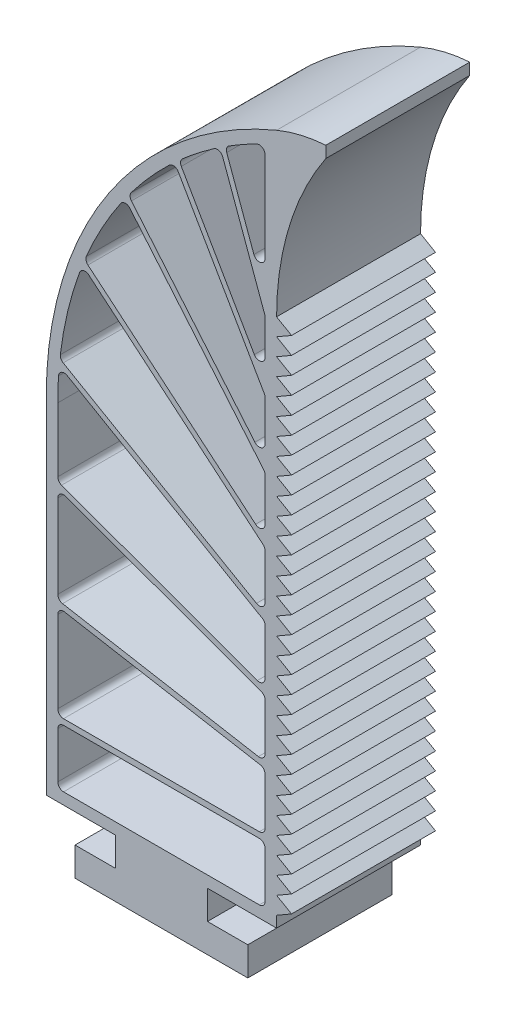
from build123d import *

# Parameters (mm, degrees)
BOSS_EXTRUDE1_DEPTH = 25
SKETCH3_W           = 36
SKETCH3_H           = 10
CUT_EXTRUDE1_DEPTH  = 134.88427839
CUT_EXTRUDE2_DEPTH  = 134.88427839
CUT_EXTRUDE3_DEPTH  = 134.88427839
CUT_EXTRUDE4_DEPTH  = 134.88427839
CUT_EXTRUDE5_DEPTH  = 134.88427839
CUT_EXTRUDE6_DEPTH  = 134.88427839
CUT_EXTRUDE7_DEPTH  = 134.88427839
CUT_EXTRUDE8_DEPTH  = 134.88427839
CUT_EXTRUDE9_DEPTH  = 134.88427839
FILLET1_R           = 1
BOSS_EXTRUDE2_DEPTH = 25
BOSS_EXTRUDE3_DEPTH = 25
LPATTERN1_COUNT     = 30
LPATTERN1_PITCH     = 3


with BuildPart() as part:
    # Sketch2 → Boss-Extrude1 (new body)
    with BuildSketch(Plane.XY):
        with BuildLine():
            Line((-15, 0), (15, 0))
            Line((15, 0), (15, 5))
            Line((15, 5), (8, 5))
            Line((8, 5), (8, 10))
            Line((8, 10), (20, 10))
            Line((20, 10), (20, 130))
            ThreePointArc((20, 130), (-9.083269132, 106.055512755), (-20, 70))
            Line((-20, 70), (-20, 10))
            Line((-20, 10), (-8, 10))
            Line((-8, 10), (-8, 5))
            Line((-8, 5), (-15, 5))
            Line((-15, 5), (-15, 0))
        make_face()
    extrude(amount=BOSS_EXTRUDE1_DEPTH)

    # Sketch3 → Cut-Extrude1 (cut, through all)
    with BuildSketch(Plane.XY.offset(25)):
        with Locations((0, 17)):
            Rectangle(SKETCH3_W, SKETCH3_H)
    extrude(amount=-CUT_EXTRUDE1_DEPTH, mode=Mode.SUBTRACT)

    # Sketch4 → Cut-Extrude2 (cut, through all)
    with BuildSketch(Plane.XY.offset(25)):
        Polygon((-18, 23), (18, 23), (18, 33), (-18, 39.347771306), align=None)
    extrude(amount=-CUT_EXTRUDE2_DEPTH, mode=Mode.SUBTRACT)

    # Sketch5 → Cut-Extrude3 (cut, through all)
    with BuildSketch(Plane.XY.offset(25)):
        Polygon((-18, 40.363197917), (18, 34.015426612), (18, 44.015426612), (-18, 57.118355045), align=None)
    extrude(amount=-CUT_EXTRUDE3_DEPTH, mode=Mode.SUBTRACT)

    # Sketch6 → Cut-Extrude4 (cut, through all)
    with BuildSketch(Plane.XY.offset(25)):
        with BuildLine():
            Line((-18, 58.182532818), (18, 45.079604384))
            Line((18, 45.079604384), (18, 55.079604384))
            Line((18, 55.079604384), (-17.740313653, 75.714284093))
            ThreePointArc((-17.740313653, 75.714284093), (-17.935044928, 72.860090894), (-18, 70))
            Line((-18, 70), (-18, 58.182532818))
        make_face()
    extrude(amount=-CUT_EXTRUDE4_DEPTH, mode=Mode.SUBTRACT)

    # Sketch12 → Cut-Extrude5 (cut, through all)
    with BuildSketch(Plane.XY.offset(25)):
        with BuildLine():
            Line((-17.631285006, 76.806036913), (18, 56.234304923))
            Line((18, 56.234304923), (18, 66.234304923))
            Line((18, 66.234304923), (-13.712387619, 92.844157678))
            ThreePointArc((-13.712387619, 92.844157678), (-16.199485709, 84.954027852), (-17.631285006, 76.806036913))
        make_face()
    extrude(amount=-CUT_EXTRUDE5_DEPTH, mode=Mode.SUBTRACT)

    # Sketch7 → Cut-Extrude6 (cut, through all)
    with BuildSketch(Plane.XY.offset(25)):
        with BuildLine():
            Line((-13.322364363, 93.822296597), (18, 67.539712212))
            Line((18, 67.539712212), (18, 77.539712212))
            Line((18, 77.539712212), (-6.326939086, 106.531429264))
            ThreePointArc((-6.326939086, 106.531429264), (-10.191692762, 100.378891521), (-13.322364363, 93.822296597))
        make_face()
    extrude(amount=-CUT_EXTRUDE6_DEPTH, mode=Mode.SUBTRACT)

    # Sketch8 → Cut-Extrude7 (cut, through all)
    with BuildSketch(Plane.XY.offset(25)):
        with BuildLine():
            Line((-5.722234691, 107.366494456), (18, 79.095436039))
            Line((18, 79.095436039), (18, 89.095436039))
            Line((18, 89.095436039), (2.287500379, 116.310283697))
            ThreePointArc((2.287500379, 116.310283697), (-1.93090917, 112.029629602), (-5.722234691, 107.366494456))
        make_face()
    extrude(amount=-CUT_EXTRUDE7_DEPTH, mode=Mode.SUBTRACT)

    # Sketch9 → Cut-Extrude8 (cut, through all)
    with BuildSketch(Plane.XY.offset(25)):
        with BuildLine():
            Line((3.04523541, 116.997848123), (18, 91.095436039))
            Line((18, 91.095436039), (18, 101.095436039))
            Line((18, 101.095436039), (10.202779023, 122.518124607))
            ThreePointArc((10.202779023, 122.518124607), (6.524875761, 119.886519369), (3.04523541, 116.997848123))
        make_face()
    extrude(amount=-CUT_EXTRUDE8_DEPTH, mode=Mode.SUBTRACT)

    # Sketch10 → Cut-Extrude9 (cut, through all)
    with BuildSketch(Plane.XY.offset(25)):
        with BuildLine():
            Line((11.063128519, 123.078138194), (18, 104.019240439))
            Line((18, 104.019240439), (18, 126.920997883))
            ThreePointArc((18, 126.920997883), (14.471038847, 125.108824438), (11.063128519, 123.078138194))
        make_face()
    extrude(amount=-CUT_EXTRUDE9_DEPTH, mode=Mode.SUBTRACT)

    # Fillet1
    fillet1_edges = [part.edges().sort_by_distance(p)[0] for p in [
        (-17.631285006, 76.806036913, 12.5),
        (-13.712387619, 92.844157678, 12.5),
        (18, 66.234304923, 12.5),
        (18, 56.234304923, 12.5),
        (-13.322364363, 93.822296597, 12.5),
        (-6.326939086, 106.531429264, 12.5),
        (18, 77.539712212, 12.5),
        (18, 67.539712212, 12.5),
        (-5.722234691, 107.366494456, 12.5),
        (2.287500379, 116.310283697, 12.5),
        (18, 89.095436039, 12.5),
        (18, 79.095436039, 12.5),
        (3.04523541, 116.997848123, 12.5),
        (10.202779023, 122.518124607, 12.5),
        (18, 101.095436039, 12.5),
        (18, 91.095436039, 12.5),
        (11.063128519, 123.078138194, 12.5),
        (18, 126.920997883, 12.5),
        (18, 104.019240439, 12.5),
        (-18, 12, 12.5),
        (-18, 22, 12.5),
        (18, 22, 12.5),
        (18, 12, 12.5),
        (-18, 23, 12.5),
        (-18, 39.347771306, 12.5),
        (18, 33, 12.5),
        (18, 23, 12.5),
        (-18, 40.363197917, 12.5),
        (-18, 57.118355045, 12.5),
        (18, 44.015426612, 12.5),
        (18, 34.015426612, 12.5),
        (-18, 58.182532818, 12.5),
        (-17.740313653, 75.714284093, 12.5),
        (18, 55.079604384, 12.5),
        (18, 45.079604384, 12.5),
    ]]
    fillet(fillet1_edges, radius=FILLET1_R)

    # Sketch13 → Boss-Extrude2 (add)
    with BuildSketch(Plane.XY.offset(25)):
        with BuildLine():
            Line((28.543587015, 132.015112463), (28.543587015, 130.015112463))
            ThreePointArc((28.543587015, 130.015112463), (22.183163486, 116.610368534), (20, 101.934676234))
            Line((20, 101.934676234), (20, 130))
            ThreePointArc((20, 130), (24.189413282, 131.356828362), (28.543587015, 132.015112463))
        make_face()
    extrude(amount=-BOSS_EXTRUDE2_DEPTH)

    # Sketch15 → Boss-Extrude3 (add)
    with BuildSketch(Plane.XY.offset(25)):
        Polygon((20, 101.934676234), (22.598076211, 100.434676234), (20, 98.934676234), align=None)
    boss_extrude3 = extrude(amount=-BOSS_EXTRUDE3_DEPTH)

    # LPattern1: Boss-Extrude3 ×30
    with Locations(*[(0, -i * LPATTERN1_PITCH, 0) for i in range(1, LPATTERN1_COUNT)]):
        add(boss_extrude3)


solid = part.part
